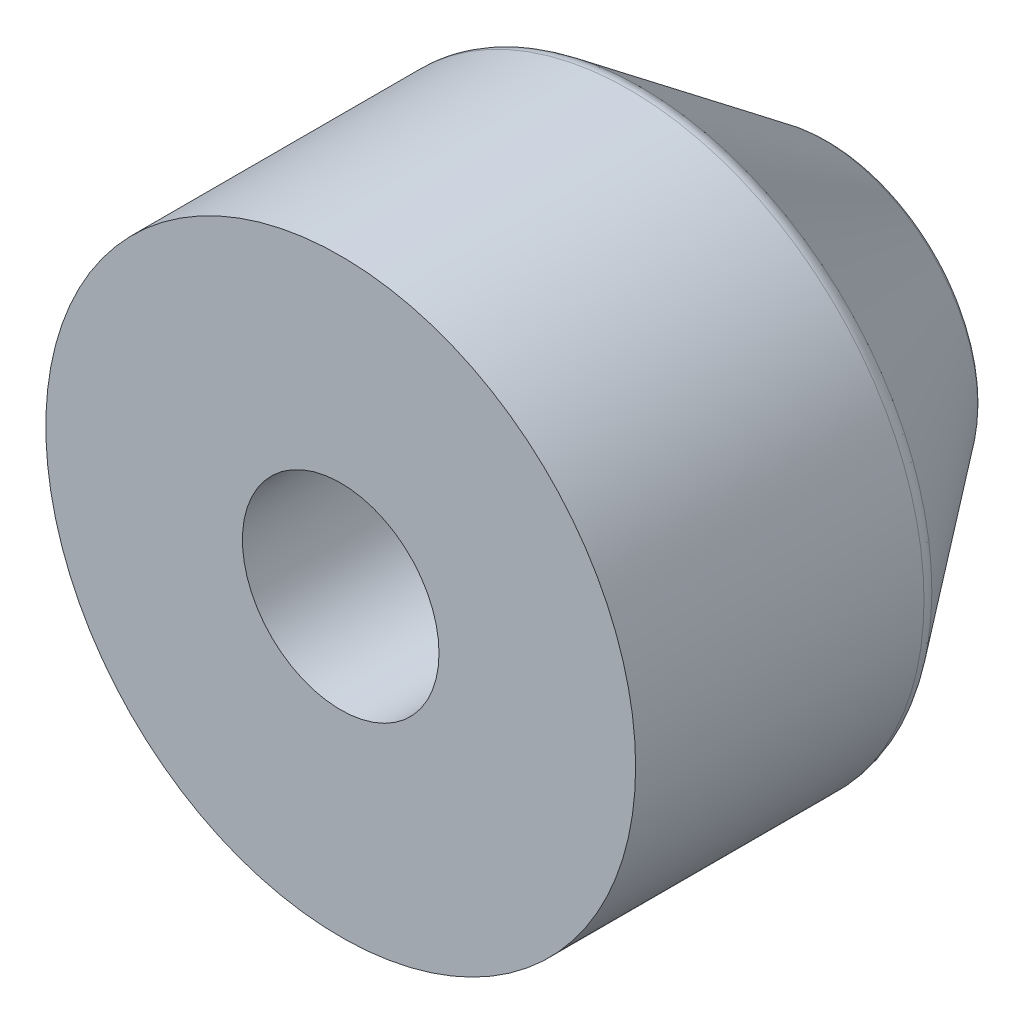
from build123d import *


with BuildPart() as part:
    # Sketch1 → Revolve1 (revolve)
    with BuildSketch(Plane(origin=(0, 0, 0), x_dir=(1, 0, 0), z_dir=(0, 1, 0))):
        with BuildLine():
            Line((5.08, 25.4), (5.08, 0))
            Line((5.08, 0), (15.24, 0))
            Line((15.24, 0), (15.24, 14.901333333))
            ThreePointArc((15.24, 14.901333333), (15.187862231, 15.222620744), (15.0368, 15.510933333))
            Line((15.0368, 15.510933333), (7.9248, 24.9936))
            ThreePointArc((7.9248, 24.9936), (7.566369013, 25.292738026), (7.112, 25.4))
            Line((7.112, 25.4), (5.08, 25.4))
        make_face()
    revolve(axis=Axis((0, 0, 0), (0, 0, -1)))


solid = part.part
